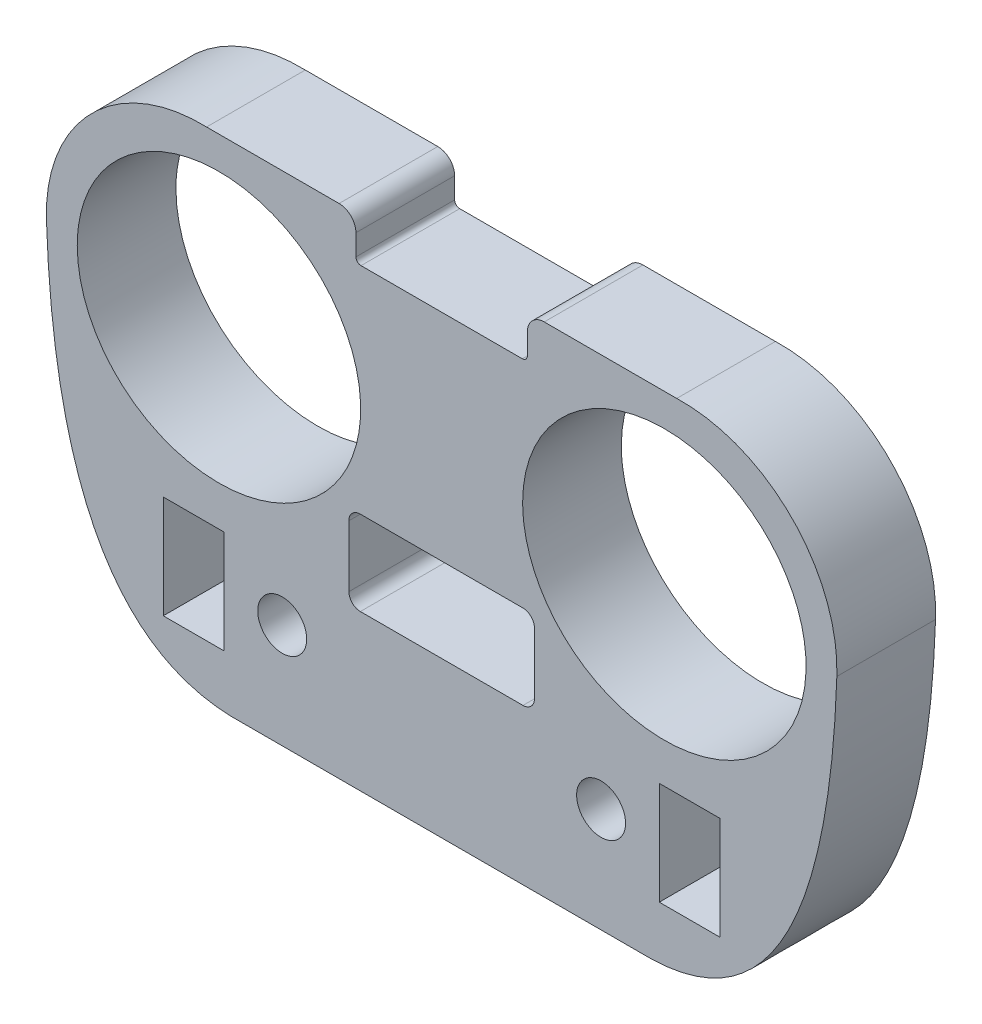
from build123d import *

# Parameters (mm, degrees)
MODEL_R             = 1.45
MODEL_RX            = 8.4
MODEL_RY            = 8
MODEL_W             = 3.6
MODEL_H             = 6.1
BOSS_EXTRUDE1_DEPTH = 5.85
FILLET1_R           = 0.3
FILLET2_R           = 1


with BuildPart() as part:
    # Model → Boss-Extrude1 (new body)
    with BuildSketch(Plane.XY):
        with BuildLine():
            Line((540.7427075, 594.649674665), (549.596103149, 594.649674665))
            Line((549.596103149, 594.649674665), (549.596103149, 592.109674665))
            Line((549.596103149, 592.109674665), (559.756103149, 592.109674665))
            Line((559.756103149, 592.109674665), (559.756103149, 594.649674665))
            Line((559.756103149, 594.649674665), (568.609498798, 594.649674665))
            ThreePointArc((568.609498798, 594.649674665), (575.419225536, 591.943953999), (578.10077955, 585.124674665))
            add(Edge.make_bspline(
                [(578.10077955, 585.124674665), (577.425296665, 565.444526899), (567.160030567, 565.124674665)],
                knots=[0, 0, 0, 1, 1, 1], degree=2))
            Line((567.160030567, 565.124674665), (542.192175731, 565.124674665))
            add(Edge.make_bspline(
                [(531.251426748, 585.124674665), (531.926909632, 565.444526899), (542.192175731, 565.124674665)],
                knots=[0, 0, 0, 1, 1, 1], degree=2))
            ThreePointArc((531.251426748, 585.124674665), (533.932980762, 591.943953999), (540.7427075, 594.649674665))
        make_face()
        with Locations((545.226103149, 571.324674665)):
            Circle(MODEL_R, mode=Mode.SUBTRACT)
        with Locations((564.126103149, 571.324674665)):
            Circle(MODEL_R, mode=Mode.SUBTRACT)
        with Locations(Location((541.476103149, 584.734674665), (0, 0, 180))):
            Ellipse(MODEL_RX, MODEL_RY, mode=Mode.SUBTRACT)
        with Locations(Location((567.876103149, 584.734674665), (0, 0, -180))):
            Ellipse(MODEL_RX, MODEL_RY, mode=Mode.SUBTRACT)
        with BuildLine():
            Line((549.856103149, 574.334674665), (554.676103149, 574.334674665))
            Line((554.676103149, 574.334674665), (559.496103149, 574.334674665))
            ThreePointArc((559.496103149, 574.334674665), (559.97693576, 574.533842054), (560.176103149, 575.014674665))
            Line((560.176103149, 575.014674665), (560.176103149, 578.654674665))
            ThreePointArc((560.176103149, 578.654674665), (559.97693576, 579.135507276), (559.496103149, 579.334674665))
            Line((559.496103149, 579.334674665), (554.676103149, 579.334674665))
            Line((554.676103149, 579.334674665), (549.856103149, 579.334674665))
            ThreePointArc((549.856103149, 579.334674665), (549.375270538, 579.135507276), (549.176103149, 578.654674665))
            Line((549.176103149, 578.654674665), (549.176103149, 575.014674665))
            ThreePointArc((549.176103149, 575.014674665), (549.375270538, 574.533842054), (549.856103149, 574.334674665))
        make_face(mode=Mode.SUBTRACT)
        with Locations((569.376103149, 571.324674665)):
            Rectangle(MODEL_W, MODEL_H, mode=Mode.SUBTRACT)
        with Locations((539.976103149, 571.324674665)):
            Rectangle(MODEL_W, MODEL_H, mode=Mode.SUBTRACT)
    extrude(amount=BOSS_EXTRUDE1_DEPTH)

    # Fillet1
    fillet1_edges = [part.edges().sort_by_distance(p)[0] for p in [
        (549.596103149, 592.109674665, 2.925),
        (559.756103149, 592.109674665, 2.925),
    ]]
    fillet(fillet1_edges, radius=FILLET1_R)

    # Fillet2
    fillet2_edges = [part.edges().sort_by_distance(p)[0] for p in [
        (549.596103149, 594.649674665, 2.925),
        (559.756103149, 594.649674665, 2.925),
    ]]
    fillet(fillet2_edges, radius=FILLET2_R)


solid = part.part
